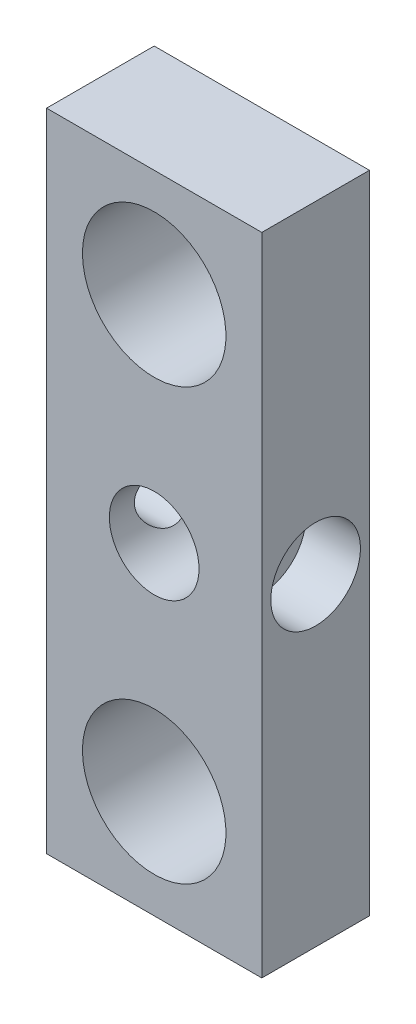
from build123d import *

# Parameters (mm, degrees)
SKETCH1_W                                       = 19.05
SKETCH1_H                                       = 57.15
SKETCH1_R                                       = 3.96875
SKETCH1_R_2                                     = 6.35
BOSS_EXTRUDE2_DEPTH                             = 9.525
CBORE_FOR_10_SOCKET_HEAD_CAP_SCREW2_D           = 5.1054
CBORE_FOR_10_SOCKET_HEAD_CAP_SCREW2_DEPTH       = 19.05
CBORE_FOR_10_SOCKET_HEAD_CAP_SCREW2_CBORE_D     = 7.9375
CBORE_FOR_10_SOCKET_HEAD_CAP_SCREW2_CBORE_DEPTH = 4.826
CBORE_FOR_10_SOCKET_HEAD_CAP_SCREW2_TIP         = 1.533816902


with BuildPart() as part:
    # Sketch1 → Boss-Extrude2 (new body)
    with BuildSketch(Plane.XY):
        with Locations((0, -200.025)):
            Rectangle(SKETCH1_W, SKETCH1_H)
        with Locations(Location((0, -200.025, 0), (0, 0, 180))):
            Circle(SKETCH1_R, mode=Mode.SUBTRACT)
        with Locations(Location((0, -180.975, 0), (0, 0, 180))):
            Circle(SKETCH1_R_2, mode=Mode.SUBTRACT)
        with Locations(Location((0, -219.075, 0), (0, 0, 180))):
            Circle(SKETCH1_R_2, mode=Mode.SUBTRACT)
    extrude(amount=BOSS_EXTRUDE2_DEPTH)

    # CBORE for #10 Socket Head Cap Screw2
    with Locations(Plane(origin=(9.525, 0, 0), x_dir=(0, 0, -1), z_dir=(1, 0, 0))):
        with Locations((-4.7625, -200.025)):
            CounterBoreHole(CBORE_FOR_10_SOCKET_HEAD_CAP_SCREW2_D / 2, CBORE_FOR_10_SOCKET_HEAD_CAP_SCREW2_CBORE_D / 2, CBORE_FOR_10_SOCKET_HEAD_CAP_SCREW2_CBORE_DEPTH, depth=CBORE_FOR_10_SOCKET_HEAD_CAP_SCREW2_DEPTH)
            with Locations((0, 0, -(CBORE_FOR_10_SOCKET_HEAD_CAP_SCREW2_DEPTH + CBORE_FOR_10_SOCKET_HEAD_CAP_SCREW2_TIP / 2))):  # 118° drill point
                Cone(0, CBORE_FOR_10_SOCKET_HEAD_CAP_SCREW2_D / 2, CBORE_FOR_10_SOCKET_HEAD_CAP_SCREW2_TIP, mode=Mode.SUBTRACT)


solid = part.part
